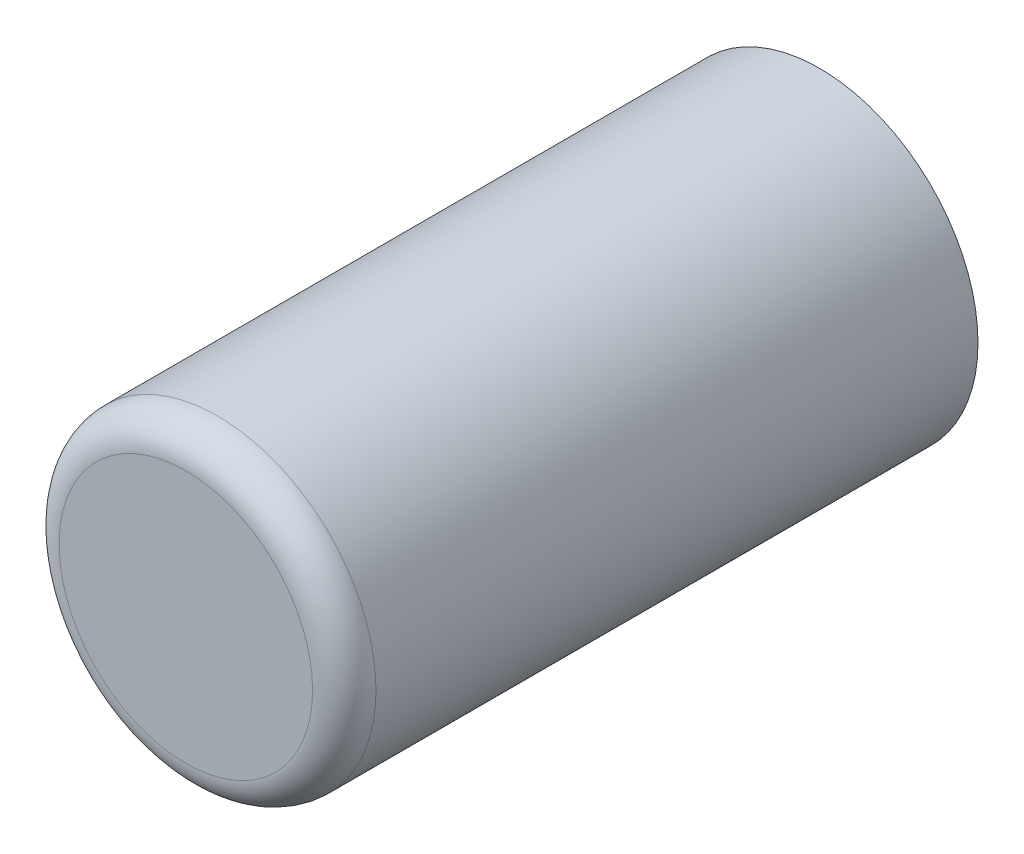
from build123d import *

# Parameters (mm, degrees)
SKETCH_1_R      = 25
EXTRUDE_1_DEPTH = 100
FILLET_1_R      = 5


with BuildPart() as part:
    # Эскиз1 → Бобышка-Вытянуть1 (new body)
    with BuildSketch(Plane.XY):
        Circle(SKETCH_1_R)
    extrude(amount=EXTRUDE_1_DEPTH)

    # Скругление1
    fillet_1_edges = [part.edges().sort_by_distance(p)[0] for p in [
        (-25, 0, 100),
    ]]
    fillet(fillet_1_edges, radius=FILLET_1_R)


solid = part.part
